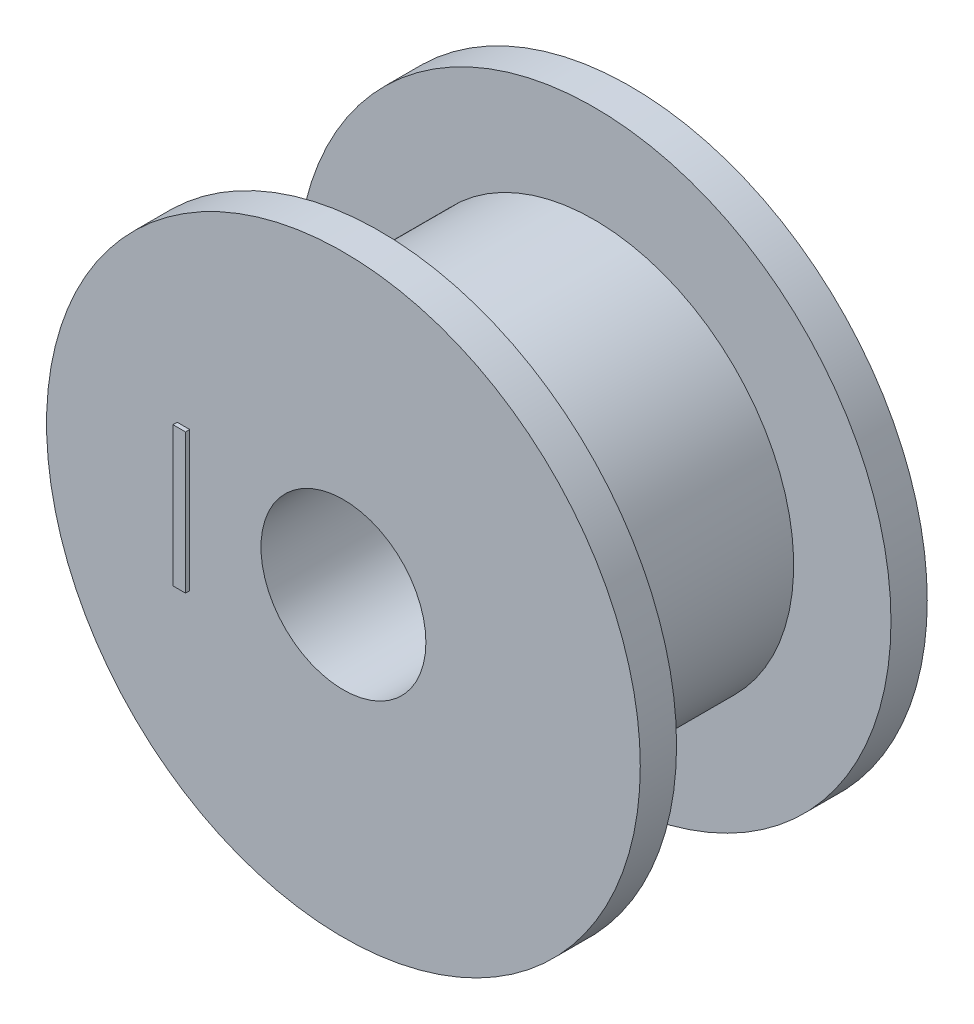
from build123d import *

# Parameters (mm, degrees)
SKETCH1_R           = 9
BOSS_EXTRUDE1_DEPTH = 1.1
SKETCH2_R           = 6.05
BOSS_EXTRUDE2_DEPTH = 6.5
SKETCH3_R           = 9
BOSS_EXTRUDE3_DEPTH = 1.1
CUT_EXTRUDE1_REACH  = 17.417
SKETCH4_R           = 2.5
SKETCH5_W           = 0.37991453
SKETCH5_H           = 4.233333334
BOSS_EXTRUDE4_DEPTH = 0.127


with BuildPart() as part:
    # Sketch1 → Boss-Extrude1 (new body)
    with BuildSketch(Plane.XY):
        Circle(SKETCH1_R)
    extrude(amount=BOSS_EXTRUDE1_DEPTH)

    # Sketch2 → Boss-Extrude2 (add)
    with BuildSketch(Plane.XY.offset(1.1)):
        with Locations(Location((0, 0, 0), (0, 0, 180))):
            Circle(SKETCH2_R)
    extrude(amount=BOSS_EXTRUDE2_DEPTH)

    # Sketch3 → Boss-Extrude3 (add)
    with BuildSketch(Plane.XY.offset(7.6)):
        Circle(SKETCH3_R)
    extrude(amount=BOSS_EXTRUDE3_DEPTH)

    # Sketch4 → Cut-Extrude1 (cut, up to next)
    with BuildSketch(Plane.XY.offset(8.7), mode=Mode.PRIVATE) as cut_extrude1_sk1:
        Circle(SKETCH4_R)
    cut_extrude1_tool1 = extrude(cut_extrude1_sk1.sketch, amount=-CUT_EXTRUDE1_REACH, mode=Mode.PRIVATE) & part.part
    add(cut_extrude1_tool1.solids().sort_by_distance((0, 0, 8.7))[0], mode=Mode.SUBTRACT)

    # Sketch5 → Boss-Extrude4 (add)
    with BuildSketch(Plane.XY.offset(8.7)):
        with Locations((-4.850266592, -0.107968693)):
            Rectangle(SKETCH5_W, SKETCH5_H)
    extrude(amount=BOSS_EXTRUDE4_DEPTH)


solid = part.part
